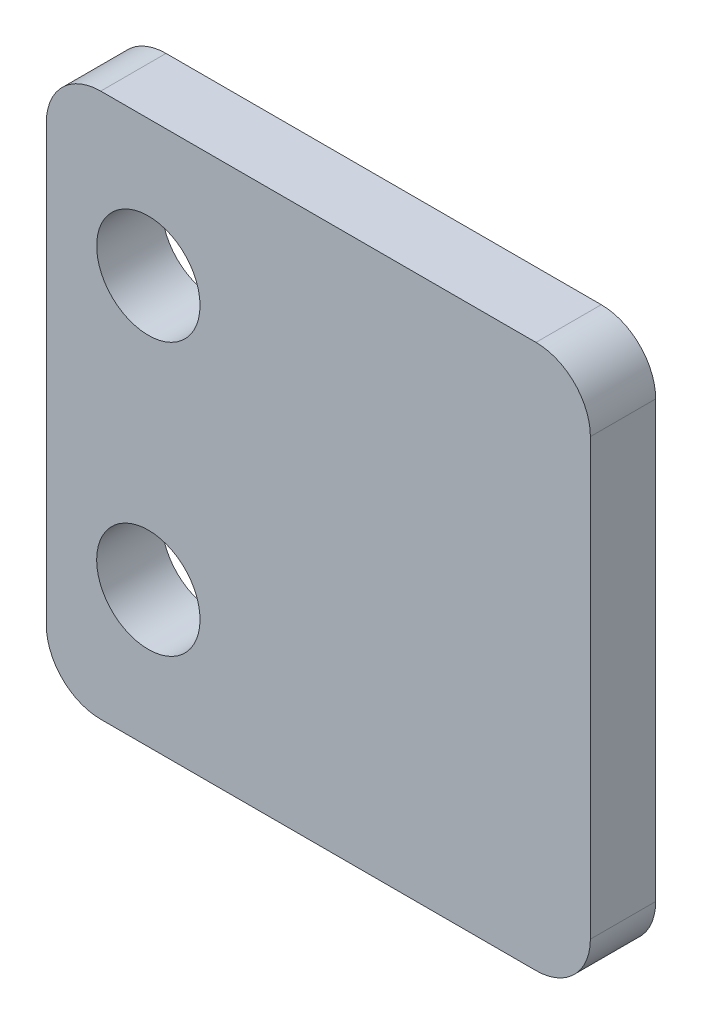
from build123d import *

# Parameters (mm, degrees)
SKETCH1_W           = 25.4
SKETCH1_H           = 25.4
BOSS_EXTRUDE1_DEPTH = 3.048
FILLET1_R           = 2.54
CUT_EXTRUDE1_REACH  = 86.831
SKETCH2_R           = 2.413


with BuildPart() as part:
    # Sketch1 → Boss-Extrude1 (new body)
    with BuildSketch(Plane.XY):
        with Locations((-71.12, 0)):
            Rectangle(SKETCH1_W, SKETCH1_H)
    extrude(amount=BOSS_EXTRUDE1_DEPTH)

    # Fillet1
    fillet1_edges = [part.edges().sort_by_distance(p)[0] for p in [
        (-58.42, 12.7, 1.524),
        (-58.42, -12.7, 1.524),
        (-83.82, -12.7, 1.524),
        (-83.82, 12.7, 1.524),
    ]]
    fillet(fillet1_edges, radius=FILLET1_R)

    # Sketch2 → Cut-Extrude1 (cut, up to next)
    with BuildSketch(Plane.XY.offset(3.048), mode=Mode.PRIVATE) as cut_extrude1_sk1:
        with Locations((-79.0575, 6.35)):
            Circle(SKETCH2_R)
    cut_extrude1_tool1 = extrude(cut_extrude1_sk1.sketch, amount=-CUT_EXTRUDE1_REACH, mode=Mode.PRIVATE) & part.part
    # Sketch2 → Cut-Extrude1 (cut, up to next)
    with BuildSketch(Plane.XY.offset(3.048), mode=Mode.PRIVATE) as cut_extrude1_sk2:
        with Locations((-79.0575, -6.35)):
            Circle(SKETCH2_R)
    cut_extrude1_tool2 = extrude(cut_extrude1_sk2.sketch, amount=-CUT_EXTRUDE1_REACH, mode=Mode.PRIVATE) & part.part
    add(cut_extrude1_tool1.solids().sort_by_distance((-79.0575, 6.35, 3.048))[0], mode=Mode.SUBTRACT)
    add(cut_extrude1_tool2.solids().sort_by_distance((-79.0575, -6.35, 3.048))[0], mode=Mode.SUBTRACT)


solid = part.part
